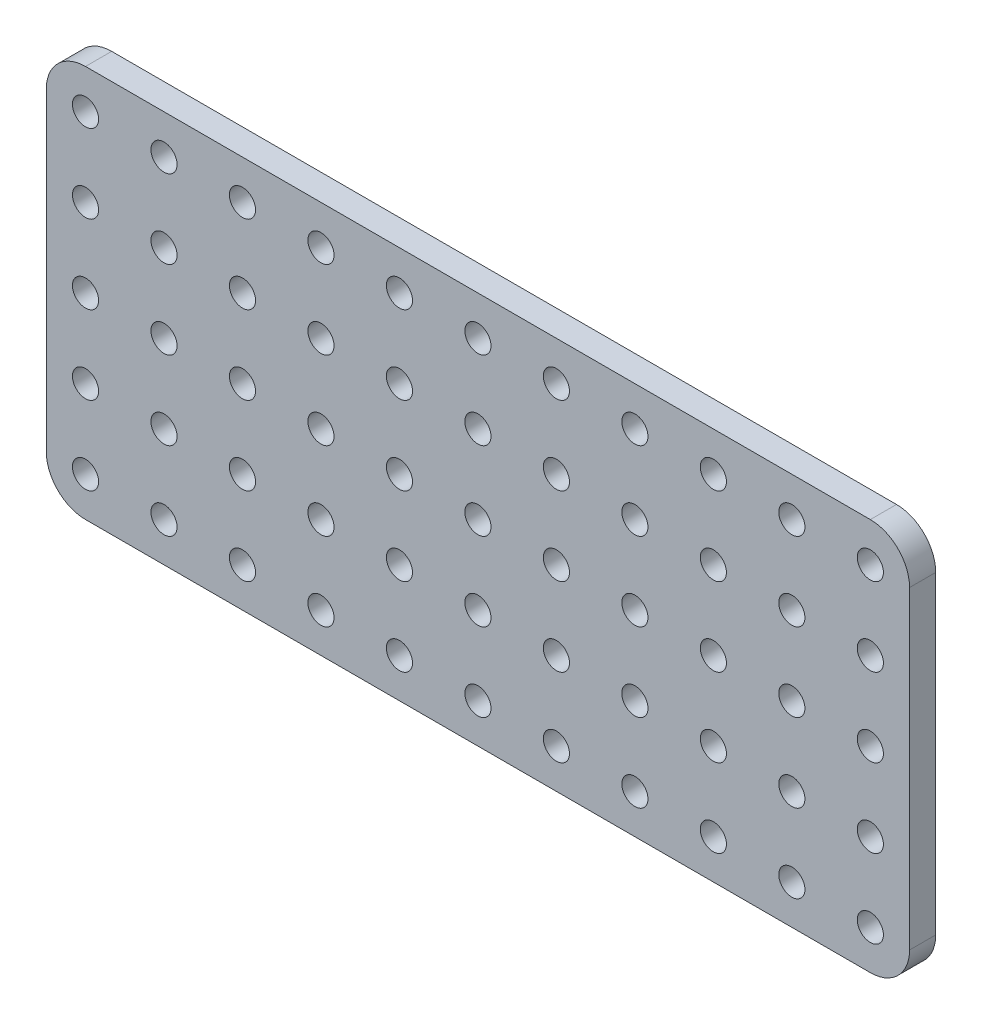
from build123d import *

# Parameters (mm, degrees)
MODEL_R                 = 1.5
SALIENTE_EXTRUIR1_DEPTH = 3


with BuildPart() as part:
    # Model → Saliente-Extruir1 (new body)
    with BuildSketch(Plane.XY):
        with BuildLine():
            Line((-105.943383637, 101.056539338), (-105.943383637, 65.056539338))
            ThreePointArc((-105.943383637, 65.056539338), (-104.625364152, 61.874558823), (-101.443383637, 60.556539338))
            Line((-101.443383637, 60.556539338), (-11.443383637, 60.556539338))
            ThreePointArc((-11.443383637, 60.556539338), (-8.261403122, 61.874558823), (-6.943383637, 65.056539338))
            Line((-6.943383637, 65.056539338), (-6.943383637, 101.056539338))
            ThreePointArc((-6.943383637, 101.056539338), (-8.261403122, 104.238519853), (-11.443383637, 105.556539338))
            Line((-11.443383637, 105.556539338), (-101.443383637, 105.556539338))
            ThreePointArc((-101.443383637, 105.556539338), (-104.625364152, 104.238519853), (-105.943383637, 101.056539338))
        make_face()
        with Locations((-101.443383637, 101.056539338)):
            Circle(MODEL_R, mode=Mode.SUBTRACT)
        with Locations((-92.443383637, 101.056539338)):
            Circle(MODEL_R, mode=Mode.SUBTRACT)
        with Locations((-83.443383637, 101.056539338)):
            Circle(MODEL_R, mode=Mode.SUBTRACT)
        with Locations((-74.443383637, 101.056539338)):
            Circle(MODEL_R, mode=Mode.SUBTRACT)
        with Locations((-65.443383637, 101.056539338)):
            Circle(MODEL_R, mode=Mode.SUBTRACT)
        with Locations((-56.443383637, 101.056539338)):
            Circle(MODEL_R, mode=Mode.SUBTRACT)
        with Locations((-47.443383637, 101.056539338)):
            Circle(MODEL_R, mode=Mode.SUBTRACT)
        with Locations((-20.443383637, 101.056539338)):
            Circle(MODEL_R, mode=Mode.SUBTRACT)
        with Locations((-101.443383637, 92.056539338)):
            Circle(MODEL_R, mode=Mode.SUBTRACT)
        with Locations((-92.443383637, 92.056539338)):
            Circle(MODEL_R, mode=Mode.SUBTRACT)
        with Locations((-83.443383637, 92.056539338)):
            Circle(MODEL_R, mode=Mode.SUBTRACT)
        with Locations((-74.443383637, 92.056539338)):
            Circle(MODEL_R, mode=Mode.SUBTRACT)
        with Locations((-65.443383637, 92.056539338)):
            Circle(MODEL_R, mode=Mode.SUBTRACT)
        with Locations((-56.443383637, 92.056539338)):
            Circle(MODEL_R, mode=Mode.SUBTRACT)
        with Locations((-47.443383637, 92.056539338)):
            Circle(MODEL_R, mode=Mode.SUBTRACT)
        with Locations((-20.443383637, 92.056539338)):
            Circle(MODEL_R, mode=Mode.SUBTRACT)
        with Locations((-101.443383637, 83.056539338)):
            Circle(MODEL_R, mode=Mode.SUBTRACT)
        with Locations((-92.443383637, 83.056539338)):
            Circle(MODEL_R, mode=Mode.SUBTRACT)
        with Locations((-83.443383637, 83.056539338)):
            Circle(MODEL_R, mode=Mode.SUBTRACT)
        with Locations((-74.443383637, 83.056539338)):
            Circle(MODEL_R, mode=Mode.SUBTRACT)
        with Locations((-65.443383637, 83.056539338)):
            Circle(MODEL_R, mode=Mode.SUBTRACT)
        with Locations((-56.443383637, 83.056539338)):
            Circle(MODEL_R, mode=Mode.SUBTRACT)
        with Locations((-47.443383637, 83.056539338)):
            Circle(MODEL_R, mode=Mode.SUBTRACT)
        with Locations((-20.443383637, 83.056539338)):
            Circle(MODEL_R, mode=Mode.SUBTRACT)
        with Locations((-101.443383637, 65.056539338)):
            Circle(MODEL_R, mode=Mode.SUBTRACT)
        with Locations((-92.443383637, 65.056539338)):
            Circle(MODEL_R, mode=Mode.SUBTRACT)
        with Locations((-83.443383637, 65.056539338)):
            Circle(MODEL_R, mode=Mode.SUBTRACT)
        with Locations((-74.443383637, 65.056539338)):
            Circle(MODEL_R, mode=Mode.SUBTRACT)
        with Locations((-65.443383637, 65.056539338)):
            Circle(MODEL_R, mode=Mode.SUBTRACT)
        with Locations((-56.443383637, 65.056539338)):
            Circle(MODEL_R, mode=Mode.SUBTRACT)
        with Locations((-47.443383637, 65.056539338)):
            Circle(MODEL_R, mode=Mode.SUBTRACT)
        with Locations((-20.443383637, 65.056539338)):
            Circle(MODEL_R, mode=Mode.SUBTRACT)
        with Locations((-11.443383637, 101.056539338)):
            Circle(MODEL_R, mode=Mode.SUBTRACT)
        with Locations((-11.443383637, 92.056539338)):
            Circle(MODEL_R, mode=Mode.SUBTRACT)
        with Locations((-11.443383637, 83.056539338)):
            Circle(MODEL_R, mode=Mode.SUBTRACT)
        with Locations((-11.443383637, 65.056539338)):
            Circle(MODEL_R, mode=Mode.SUBTRACT)
        with Locations((-101.443383637, 74.056539338)):
            Circle(MODEL_R, mode=Mode.SUBTRACT)
        with Locations((-92.443383637, 74.056539338)):
            Circle(MODEL_R, mode=Mode.SUBTRACT)
        with Locations((-83.443383637, 74.056539338)):
            Circle(MODEL_R, mode=Mode.SUBTRACT)
        with Locations((-74.443383637, 74.056539338)):
            Circle(MODEL_R, mode=Mode.SUBTRACT)
        with Locations((-65.443383637, 74.056539338)):
            Circle(MODEL_R, mode=Mode.SUBTRACT)
        with Locations((-56.443383637, 74.056539338)):
            Circle(MODEL_R, mode=Mode.SUBTRACT)
        with Locations((-47.443383637, 74.056539338)):
            Circle(MODEL_R, mode=Mode.SUBTRACT)
        with Locations((-20.443383637, 74.056539338)):
            Circle(MODEL_R, mode=Mode.SUBTRACT)
        with Locations((-11.443383637, 74.056539338)):
            Circle(MODEL_R, mode=Mode.SUBTRACT)
        with Locations((-38.443383637, 101.056539338)):
            Circle(MODEL_R, mode=Mode.SUBTRACT)
        with Locations((-29.443383637, 101.056539338)):
            Circle(MODEL_R, mode=Mode.SUBTRACT)
        with Locations((-38.443383637, 92.056539338)):
            Circle(MODEL_R, mode=Mode.SUBTRACT)
        with Locations((-29.443383637, 92.056539338)):
            Circle(MODEL_R, mode=Mode.SUBTRACT)
        with Locations((-38.443383637, 83.056539338)):
            Circle(MODEL_R, mode=Mode.SUBTRACT)
        with Locations((-29.443383637, 83.056539338)):
            Circle(MODEL_R, mode=Mode.SUBTRACT)
        with Locations((-38.443383637, 65.056539338)):
            Circle(MODEL_R, mode=Mode.SUBTRACT)
        with Locations((-29.443383637, 65.056539338)):
            Circle(MODEL_R, mode=Mode.SUBTRACT)
        with Locations((-38.443383637, 74.056539338)):
            Circle(MODEL_R, mode=Mode.SUBTRACT)
        with Locations((-29.443383637, 74.056539338)):
            Circle(MODEL_R, mode=Mode.SUBTRACT)
    extrude(amount=SALIENTE_EXTRUIR1_DEPTH)


solid = part.part
